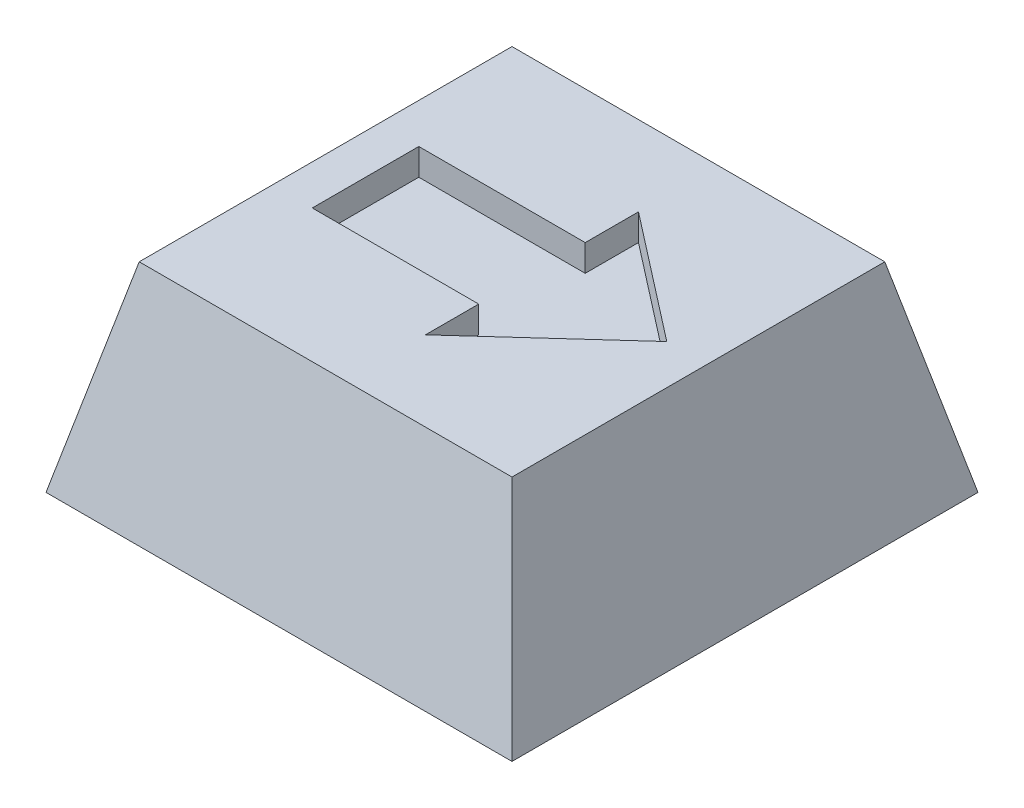
from build123d import *

# Parameters (mm, degrees)
SKETCH1_W           = 7
SKETCH1_H           = 7
BOSS_EXTRUDE1_DEPTH = 3
CUT_EXTRUDE1_DEPTH  = 7
CUT_EXTRUDE2_DEPTH  = 11
SKETCH4_R           = 1.8
CUT_EXTRUDE3_DEPTH  = 0.8
SKETCH5_W           = 2.5
SKETCH5_H           = 1.6
CUT_EXTRUDE4_DEPTH  = 0.4


with BuildPart() as part:
    # Sketch1 → Boss-Extrude1 (new body)
    with BuildSketch(Plane(origin=(0, 0, 0), x_dir=(1, 0, 0), z_dir=(0, 1, 0))):
        with Locations((3.5, 3.5)):
            Rectangle(SKETCH1_W, SKETCH1_H)
    extrude(amount=BOSS_EXTRUDE1_DEPTH)

    # Sketch2 → Cut-Extrude1 (cut)
    with BuildSketch(Plane.XY):
        Polygon((0, 0), (0.7, 3), (0, 3), align=None)
        Polygon((7, 0), (6.3, 3), (7, 3), align=None)
    extrude(amount=-CUT_EXTRUDE1_DEPTH, mode=Mode.SUBTRACT)

    # Sketch3 → Cut-Extrude2 (cut)
    with BuildSketch(Plane(origin=(0, 0, 0), x_dir=(0, 0, -1), z_dir=(1, 0, 0))):
        Polygon((0, 0), (0.7, 3), (0, 3), align=None)
        Polygon((7, 3), (6.3, 3), (7, 0), align=None)
    extrude(amount=CUT_EXTRUDE2_DEPTH, mode=Mode.SUBTRACT)

    # Sketch4 → Cut-Extrude3 (cut)
    with BuildSketch(Plane.XZ):
        with Locations(Location((3.5, -3.5, 0), (0, 0, 270))):
            Circle(SKETCH4_R)
    extrude(amount=-CUT_EXTRUDE3_DEPTH, mode=Mode.SUBTRACT)

    # Sketch5 → Cut-Extrude4 (cut)
    with BuildSketch(Plane(origin=(0, 3, 0), x_dir=(1, 0, 0), z_dir=(0, 1, 0))):
        with Locations((2.55, 3.5)):
            Rectangle(SKETCH5_W, SKETCH5_H)
        Polygon((3.8, 1.9), (3.8, 2.7), (3.8, 4.3), (3.8, 5.1), (5.7, 3.624818901), align=None)
    extrude(amount=-CUT_EXTRUDE4_DEPTH, mode=Mode.SUBTRACT)


solid = part.part
